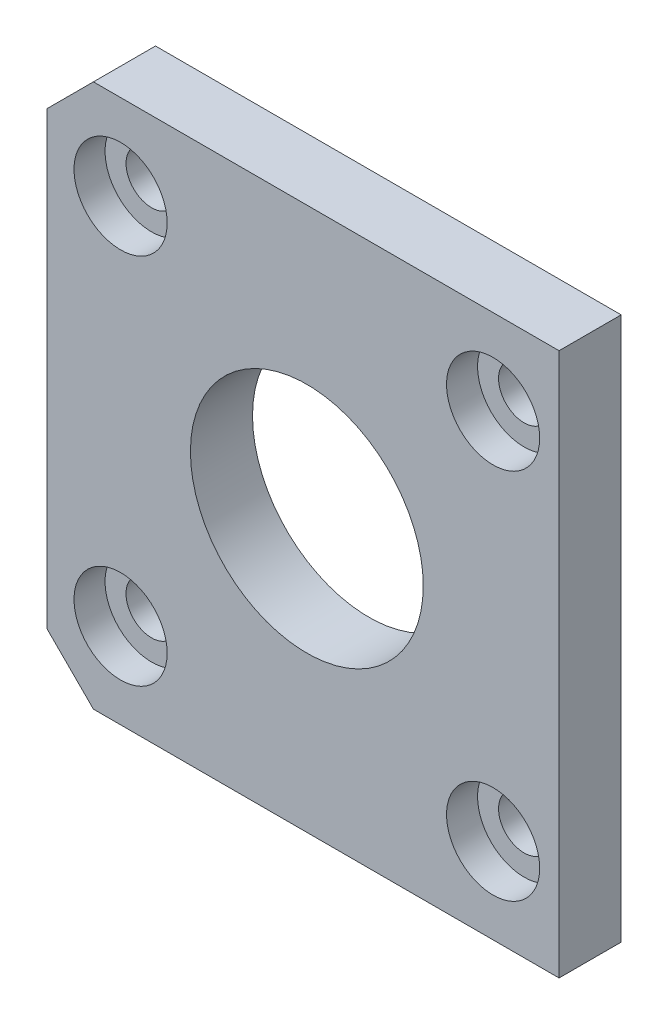
from build123d import *

# Parameters (mm, degrees)
SKETCH_1_R          = 7.5
SKETCH_1_R_2        = 1.65
EXTRUDE_1_DEPTH     = 4
SKETCH_2_R          = 3
CUT_EXTRUDE_1_DEPTH = 2


with BuildPart() as part:
    # 草图1 → 凸台-拉伸1 (new body)
    with BuildSketch(Plane.XY):
        Polygon((0, 32), (3, 35), (33, 35), (33, 0), (3, 0), (0, 3), align=None)
        with Locations((16.75, 17.5)):
            Circle(SKETCH_1_R, mode=Mode.SUBTRACT)
        with Locations((4.75, 29.5)):
            Circle(SKETCH_1_R_2, mode=Mode.SUBTRACT)
        with Locations((28.75, 29.5)):
            Circle(SKETCH_1_R_2, mode=Mode.SUBTRACT)
        with Locations((4.75, 5.5)):
            Circle(SKETCH_1_R_2, mode=Mode.SUBTRACT)
        with Locations((28.75, 5.5)):
            Circle(SKETCH_1_R_2, mode=Mode.SUBTRACT)
    extrude(amount=EXTRUDE_1_DEPTH)

    # 草图2 → 切除-拉伸1 (cut)
    with BuildSketch(Plane.XY.offset(4)):
        with Locations((4.75, 29.5)):
            Circle(SKETCH_2_R)
        with Locations((28.75, 29.5)):
            Circle(SKETCH_2_R)
        with Locations((4.75, 5.5)):
            Circle(SKETCH_2_R)
        with Locations((28.75, 5.5)):
            Circle(SKETCH_2_R)
    extrude(amount=-CUT_EXTRUDE_1_DEPTH, mode=Mode.SUBTRACT)


solid = part.part
